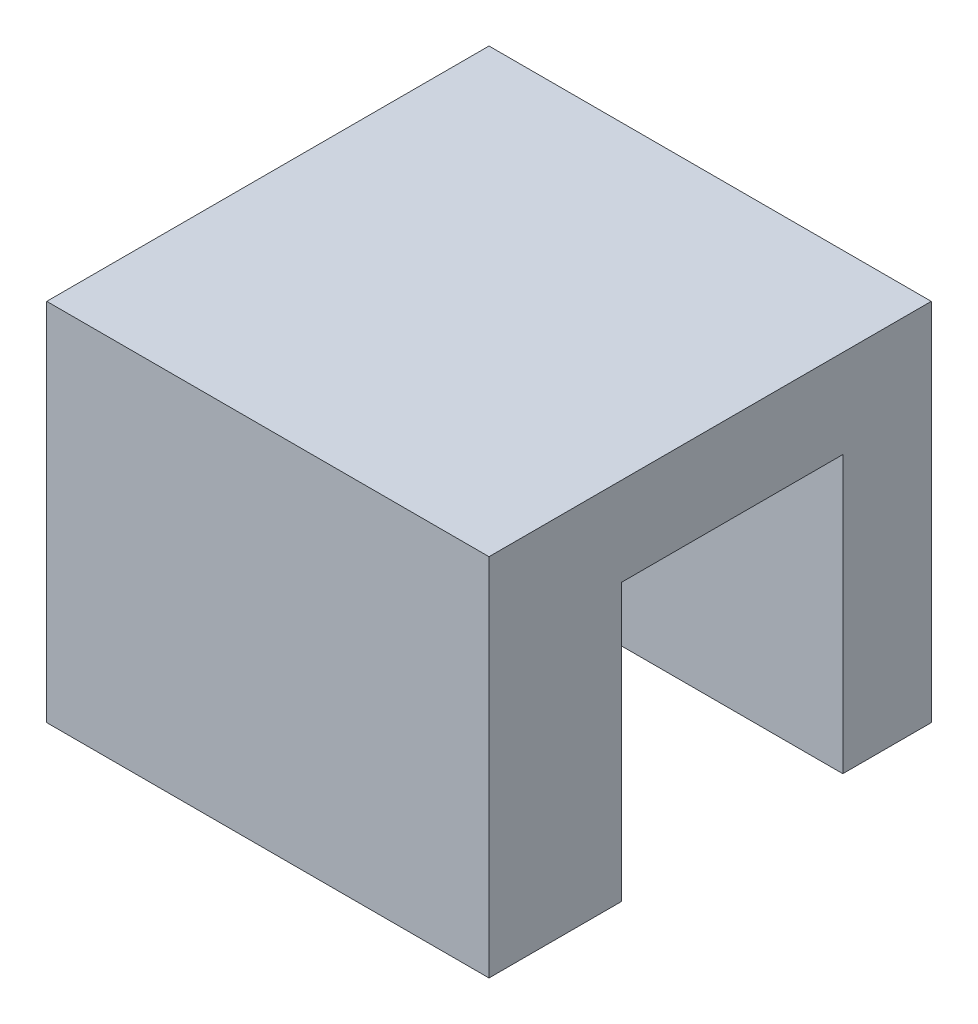
from build123d import *

# Parameters (mm, degrees)
BOSS_EXTRUDE1_DEPTH = 12.5
BOSS_EXTRUDE4_DEPTH = 20


with BuildPart() as part:
    # Sketch1 → Boss-Extrude1 (new body)
    with BuildSketch(Plane(origin=(0, 0, 0), x_dir=(1, 0, 0), z_dir=(0, 1, 0))):
        Polygon((-2.564516129, 3.29516129), (14.435483871, 3.29516129), (14.435483871, -2.70483871), (-5.564516129, -2.70483871), (-5.564516129, 3.29516129), (-4.064516129, 3.29516129), align=None)
    extrude(amount=BOSS_EXTRUDE1_DEPTH)

    # Sketch2 → Boss-Extrude4 (add)
    with BuildSketch(Plane(origin=(14.435483871, 0, 0), x_dir=(0, 0, -1), z_dir=(1, 0, 0))):
        Polygon((-2.70483871, 12.5), (13.29516129, 12.5), (13.29516129, 0), (17.29516129, 0), (17.29516129, 12.5), (17.29516129, 16.5), (-2.70483871, 16.5), align=None)
    extrude(amount=-BOSS_EXTRUDE4_DEPTH)


solid = part.part
